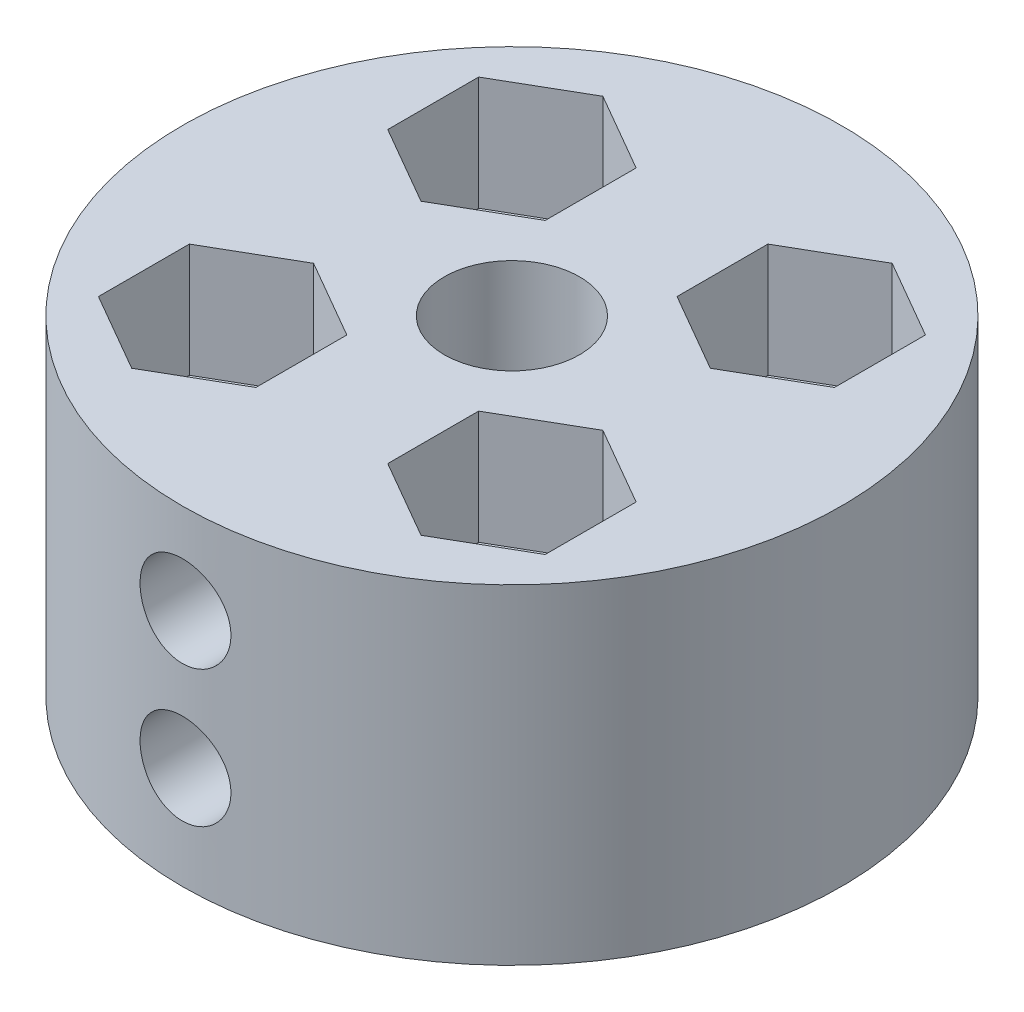
from build123d import *
from build123d.topology import SkipClean

# Parameters (mm, degrees)
CROQUIS1_R              = 14.5
SALIENTE_EXTRUIR1_DEPTH = 14.5
CORTAR_EXTRUIR1_DEPTH   = 26.11473671
CORTAR_EXTRUIR2_DEPTH   = 26.11473671
CORTAR_EXTRUIR3_DEPTH   = 5
MATRIZL1_COUNT          = 2
MATRIZL1_PITCH          = 12.728
MATRIZL1_COUNT_DIR2     = 2
MATRIZL1_PITCH_DIR2     = 12.728
CROQUIS6_R              = 2
CORTAR_EXTRUIR4_DEPTH   = 11.998295581
CORTAR_EXTRUIR5_DEPTH   = 1
CORTAR_EXTRUIR9_DEPTH   = 1.9


with BuildPart() as part:
    # Croquis1 → Saliente-Extruir1 (new body)
    with BuildSketch(Plane(origin=(0, 0, 0), x_dir=(1, 0, 0), z_dir=(0, 1, 0))):
        with Locations(Location((0, 0, 0), (0, 0, 90))):
            Circle(CROQUIS1_R)
    extrude(amount=SALIENTE_EXTRUIR1_DEPTH)

    # Croquis2 → Cortar-Extruir1 (cut, through all)
    with BuildSketch(Plane(origin=(0, 14.5, 0), x_dir=(1, 0, 0), z_dir=(0, 1, 0))):
        with BuildLine():
            Line((-1.61, -2.501704419), (1.61, -2.501704419))
            ThreePointArc((1.61, -2.501704419), (0, 2.975), (-1.61, -2.501704419))
        make_face()
    extrude(amount=-CORTAR_EXTRUIR1_DEPTH, mode=Mode.SUBTRACT)

    # Croquis3 → Cortar-Extruir2 (cut, through all)
    with BuildSketch(Plane(origin=(0, 14.5, 0), x_dir=(1, 0, 0), z_dir=(0, 1, 0))):
        with BuildLine():
            ThreePointArc((-4.364, 6.364), (-7.778213562, 7.778213562), (-6.364, 4.364))
            Line((-6.364, 4.364), (-6.364, 6.364))
            Line((-6.364, 6.364), (-4.364, 6.364))
        make_face()
        with BuildLine():
            Line((-6.364, 6.364), (-6.364, 4.364))
            ThreePointArc((-6.364, 4.364), (-4.949786438, 4.949786438), (-4.364, 6.364))
            Line((-4.364, 6.364), (-6.364, 6.364))
        make_face()
        with BuildLine():
            Line((-6.364, -4.364), (-6.364, -6.364))
            Line((-6.364, -6.364), (-4.364, -6.364))
            ThreePointArc((-4.364, -6.364), (-4.949786438, -4.949786438), (-6.364, -4.364))
        make_face()
        with BuildLine():
            Line((-4.364, -6.364), (-6.364, -6.364))
            Line((-6.364, -6.364), (-6.364, -4.364))
            ThreePointArc((-6.364, -4.364), (-7.778213562, -7.778213562), (-4.364, -6.364))
        make_face()
        with BuildLine():
            ThreePointArc((6.364, -4.364), (4.949786438, -4.949786438), (4.364, -6.364))
            Line((4.364, -6.364), (6.364, -6.364))
            Line((6.364, -6.364), (6.364, -4.364))
        make_face()
        with BuildLine():
            Line((6.364, -6.364), (4.364, -6.364))
            ThreePointArc((4.364, -6.364), (6.364, -8.364), (8.364, -6.364))
            ThreePointArc((8.364, -6.364), (7.778213562, -4.949786438), (6.364, -4.364))
            Line((6.364, -4.364), (6.364, -6.364))
        make_face()
        with BuildLine():
            ThreePointArc((4.364, 6.364), (4.949786438, 4.949786438), (6.364, 4.364))
            Line((6.364, 4.364), (6.364, 6.364))
            Line((6.364, 6.364), (4.364, 6.364))
        make_face()
        with BuildLine():
            Line((6.364, 6.364), (6.364, 4.364))
            ThreePointArc((6.364, 4.364), (7.778213562, 4.949786438), (8.364, 6.364))
            ThreePointArc((8.364, 6.364), (6.364, 8.364), (4.364, 6.364))
            Line((4.364, 6.364), (6.364, 6.364))
        make_face()
    extrude(amount=-CORTAR_EXTRUIR2_DEPTH, mode=Mode.SUBTRACT)

    # Croquis5 → Cortar-Extruir3 (cut)
    with BuildSketch(Plane(origin=(0, 14.5, 0), x_dir=(1, 0, 0), z_dir=(0, 1, 0))):
        Polygon((-6.364, 2.364), (-2.899898385, 4.364), (-2.899898385, 8.364), (-6.364, 10.364), (-9.828101615, 8.364), (-9.828101615, 4.364), align=None)
    cortar_extruir3 = extrude(amount=-CORTAR_EXTRUIR3_DEPTH, mode=Mode.SUBTRACT)

    # MatrizL1: Cortar-Extruir3 2 × 2
    with Locations(*[(i * MATRIZL1_PITCH, 0, j * MATRIZL1_PITCH_DIR2) for i in range(MATRIZL1_COUNT) for j in range(MATRIZL1_COUNT_DIR2) if (i, j) != (0, 0)]):
        add(cortar_extruir3, mode=Mode.SUBTRACT)

    # Croquis6 → Cortar-Extruir4 (cut)
    with BuildSketch(Plane.XY.offset(14.5)):
        with Locations((0, 10.5)):
            Circle(CROQUIS6_R)
        with Locations((0, 4.5)):
            Circle(CROQUIS6_R)
    extrude(amount=-CORTAR_EXTRUIR4_DEPTH, mode=Mode.SUBTRACT)

    # Croquis9 → Cortar-Extruir5 (cut)
    with SkipClean():  # the faces are left unmerged after this step: merging them gives an invalid solid
        with BuildSketch(Plane.XY.offset(2.501704419)):
            with BuildLine():
                Line((-1.61, 11.68654962), (-1.61, 9.31345038))
                ThreePointArc((-1.61, 9.31345038), (-2, 10.5), (-1.61, 11.68654962))
            make_face()
            with BuildLine():
                Line((1.61, 11.68654962), (1.61, 9.31345038))
                ThreePointArc((1.61, 9.31345038), (2, 10.5), (1.61, 11.68654962))
            make_face()
            with BuildLine():
                Line((-1.61, 5.68654962), (-1.61, 3.31345038))
                ThreePointArc((-1.61, 3.31345038), (-2, 4.5), (-1.61, 5.68654962))
            make_face()
            with BuildLine():
                Line((1.61, 5.68654962), (1.61, 3.31345038))
                ThreePointArc((1.61, 3.31345038), (2, 4.5), (1.61, 5.68654962))
            make_face()
        extrude(amount=-CORTAR_EXTRUIR5_DEPTH, mode=Mode.SUBTRACT)

    # Croquis11 → Cortar-Extruir9 (cut)
    with SkipClean():  # the faces are left unmerged after this step: merging them gives an invalid solid
        with BuildSketch(Plane(origin=(0, 14.5, 0), x_dir=(1, 0, 0), z_dir=(0, 1, 0))):
            with BuildLine():
                ThreePointArc((2.975, 0), (-1.424934209, 2.61154887), (-1.61, -2.501704419))
                Line((-1.61, -2.501704419), (1.61, -2.501704419))
                ThreePointArc((1.61, -2.501704419), (2.61154887, -1.424934209), (2.975, 0))
            make_face()
            with BuildLine():
                Line((1.61, -2.501704419), (-1.61, -2.501704419))
                ThreePointArc((-1.61, -2.501704419), (0, -2.975), (1.61, -2.501704419))
            make_face()
        extrude(amount=-CORTAR_EXTRUIR9_DEPTH, mode=Mode.SUBTRACT)


solid = part.part
